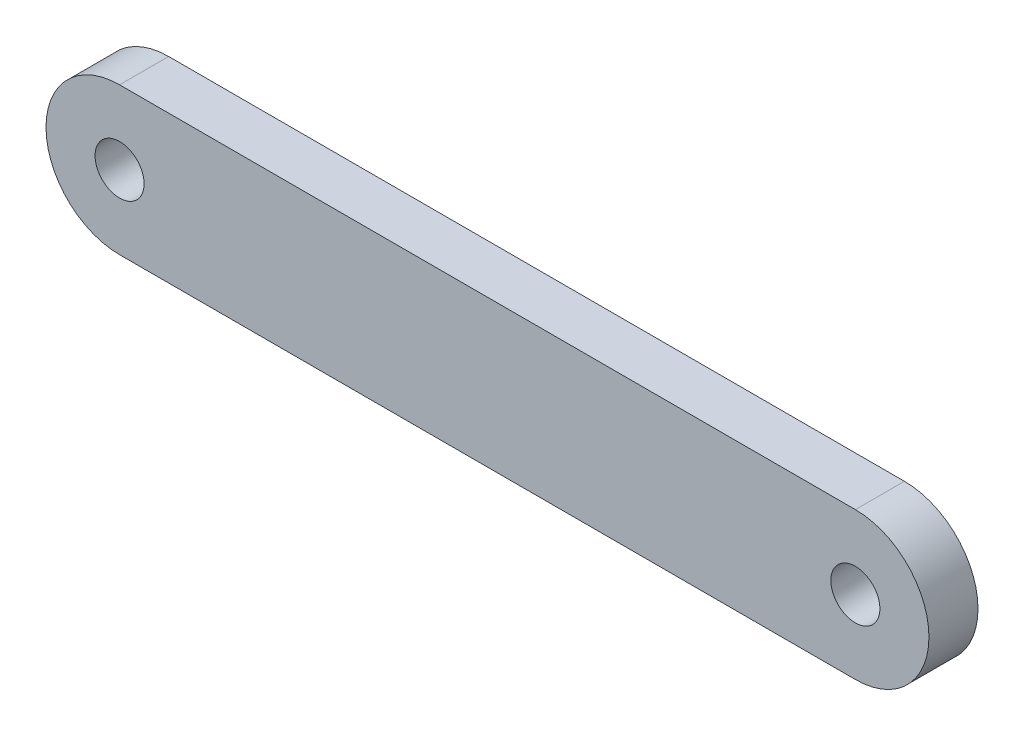
from build123d import *

# Parameters (mm, degrees)
IZIM1_R                     = 5
Y_KSEKLIK_EKSTR_ZYON1_DEPTH = 5


with BuildPart() as part:
    # Çizim1 → Yükseklik-Ekstrüzyon1 (new, symmetric)
    with BuildSketch(Plane.XY):
        with BuildLine():
            Line((-75, 15), (75, 15))
            ThreePointArc((75, 15), (90, 0), (75, -15))
            Line((75, -15), (-75, -15))
            ThreePointArc((-75, -15), (-90, 0), (-75, 15))
        make_face()
        with Locations((75, 0)):
            Circle(IZIM1_R, mode=Mode.SUBTRACT)
        with Locations((-75, 0)):
            Circle(IZIM1_R, mode=Mode.SUBTRACT)
    extrude(amount=Y_KSEKLIK_EKSTR_ZYON1_DEPTH, both=True)


solid = part.part
